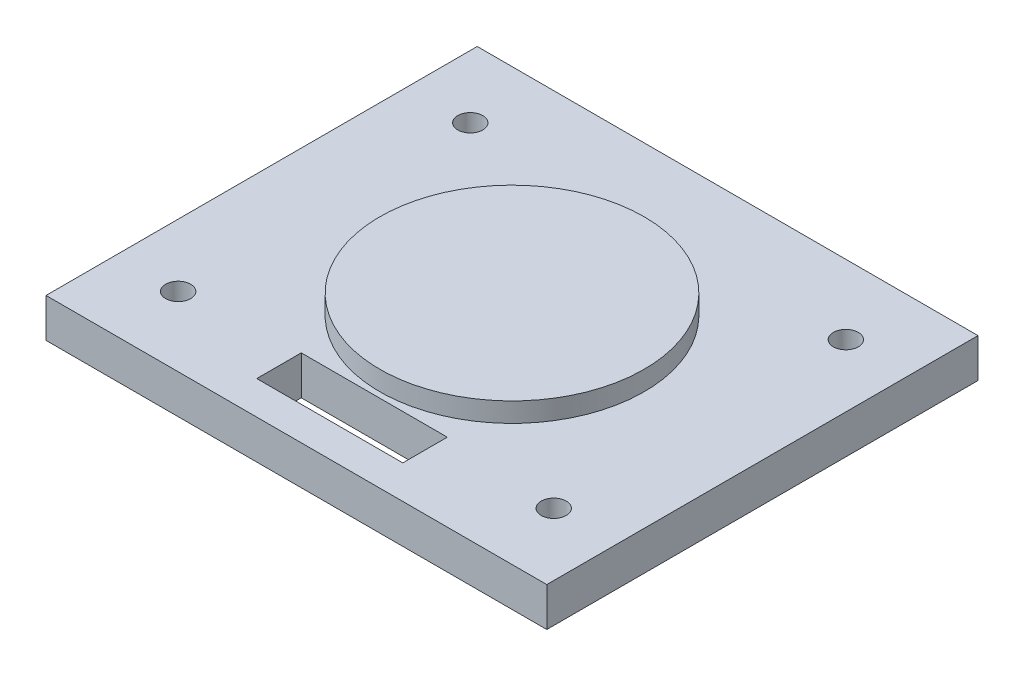
from build123d import *

# Parameters (mm, degrees)
F_01_BASE_PROFILE_W           = 360
F_01_BASE_PROFILE_H           = 310
F_01_BASE_PROFILE_R           = 62.5
F_01_BASE_PROFILE_R_2         = 9
F_01_BASE_PROFILE_W_2         = 105
F_01_BASE_PROFILE_H_2         = 32
F_01_BASE_EXTRUDE_DEPTH       = 28
F_02_BOSS_PROFILE_R           = 95
F_02_REINFORCEMENT_BOSS_DEPTH = 42


with BuildPart() as part:
    # 01_Base_Profile → 01_Base_Extrude (new body)
    with BuildSketch(Plane(origin=(0, 0, 0), x_dir=(1, 0, 0), z_dir=(0, 1, 0))):
        Rectangle(F_01_BASE_PROFILE_W, F_01_BASE_PROFILE_H)
        with Locations(Location((0, 0, 0), (0, 0, 270))):
            Circle(F_01_BASE_PROFILE_R, mode=Mode.SUBTRACT)
        with Locations(Location((-135, -105, 0), (0, 0, 270))):
            Circle(F_01_BASE_PROFILE_R_2, mode=Mode.SUBTRACT)
        with Locations(Location((135, -105, 0), (0, 0, 270))):
            Circle(F_01_BASE_PROFILE_R_2, mode=Mode.SUBTRACT)
        with Locations(Location((-135, 105, 0), (0, 0, 270))):
            Circle(F_01_BASE_PROFILE_R_2, mode=Mode.SUBTRACT)
        with Locations(Location((135, 105, 0), (0, 0, 270))):
            Circle(F_01_BASE_PROFILE_R_2, mode=Mode.SUBTRACT)
        with Locations((0, -115)):
            Rectangle(F_01_BASE_PROFILE_W_2, F_01_BASE_PROFILE_H_2, mode=Mode.SUBTRACT)
    extrude(amount=F_01_BASE_EXTRUDE_DEPTH)

    # 02_Boss_Profile → 02_Reinforcement_Boss (add)
    with BuildSketch(Plane(origin=(0, 0, 0), x_dir=(1, 0, 0), z_dir=(0, 1, 0))):
        with Locations(Location((0, 0, 0), (0, 0, 90))):
            Circle(F_02_BOSS_PROFILE_R)
    extrude(amount=F_02_REINFORCEMENT_BOSS_DEPTH)


solid = part.part
